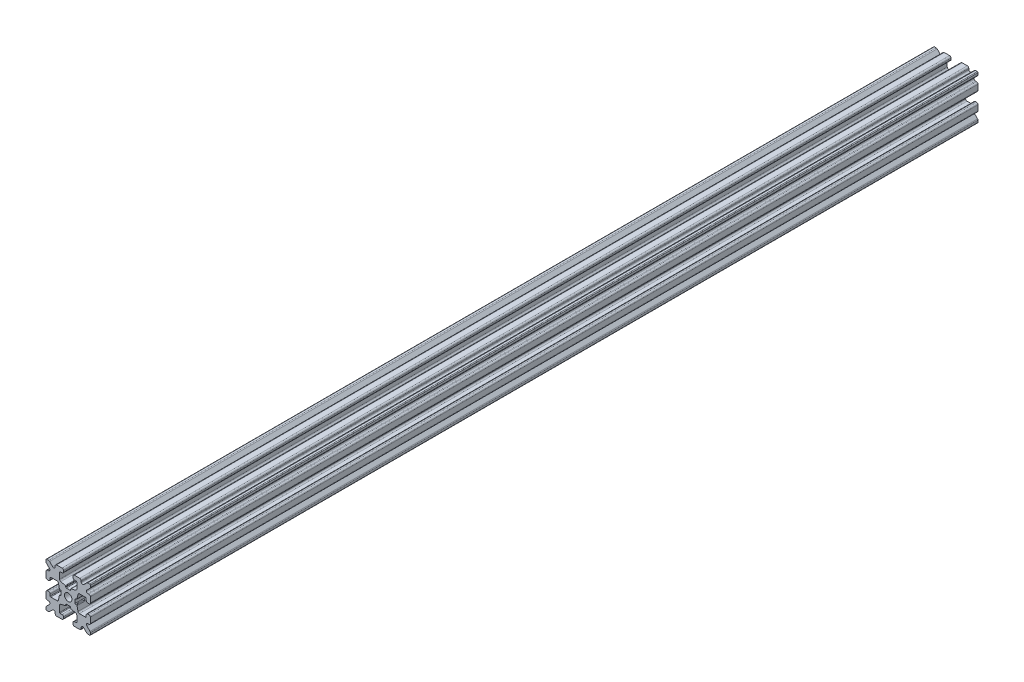
from build123d import *

# Parameters (mm, degrees)
SKETCH1_W           = 15
SKETCH1_H           = 15
SKETCH1_R           = 1.25
BOSS_EXTRUDE1_DEPTH = 150
FILLET1_R           = 0.25
CUT_EXTRUDE1_DEPTH  = 301.187441443
CUT_EXTRUDE3_DEPTH  = 301.187441443
FILLET3_R           = 0.5
FILLET4_R           = 0.5
FILLET5_R           = 3
FILLET6_R           = 0.2
CUT_EXTRUDE4_DEPTH  = 301.187441443
FILLET8_R           = 0.5
SKETCH6_W           = 5.1529354
SKETCH6_H           = 1.651
SKETCH6_W_2         = 1.651
SKETCH6_H_2         = 5.1529354
CUT_EXTRUDE5_DEPTH  = 301.187441443
FILLET10_R          = 0.2


with BuildPart() as part:
    # Sketch1 → Boss-Extrude1 (new, symmetric)
    with BuildSketch(Plane.XY):
        Rectangle(SKETCH1_W, SKETCH1_H)
        Circle(SKETCH1_R, mode=Mode.SUBTRACT)
    extrude(amount=BOSS_EXTRUDE1_DEPTH, both=True)

    # Fillet1
    fillet1_edges = [part.edges().sort_by_distance(p)[0] for p in [
        (7.5, -7.5, 0),
        (-7.5, -7.5, 0),
        (-7.5, 7.5, 0),
        (7.5, 7.5, 0),
    ]]
    fillet(fillet1_edges, radius=FILLET1_R)

    # Sketch2 → Cut-Extrude1 (cut, through all)
    with BuildSketch(Plane.XY.offset(150)):
        Polygon((-7.5, 1.6), (-6.1, 1.6), (-6.1, 2.9), (-3.4, 2.9), (-3.4, -2.9), (-6.1, -2.9), (-6.1, -1.6), (-7.5, -1.6), align=None)
        Polygon((2.9, 6.1), (1.6, 6.1), (1.6, 7.5), (-1.6, 7.5), (-1.6, 6.1), (-2.9, 6.1), (-2.9, 3.4), (2.9, 3.4), align=None)
        Polygon((-1.6, -7.5), (-1.6, -6.1), (-2.9, -6.1), (-2.9, -3.4), (2.9, -3.4), (2.9, -6.1), (1.6, -6.1), (1.6, -7.5), align=None)
        Polygon((6.1, -2.9), (6.1, -1.6), (7.5, -1.6), (7.5, 1.6), (6.1, 1.6), (6.1, 2.9), (3.4, 2.9), (3.4, -2.9), align=None)
    extrude(amount=-CUT_EXTRUDE1_DEPTH, mode=Mode.SUBTRACT)

    # Sketch4 → Cut-Extrude3 (cut, through all)
    with BuildSketch(Plane.XY.offset(150)):
        Polygon((-3.4, 2.9), (-2.75, 0), (-3.4, -2.9), align=None)
        Polygon((-2.9, 3.4), (0, 2.75), (2.9, 3.4), align=None)
        Polygon((3.4, 2.9), (2.75, 0), (3.4, -2.9), align=None)
        Polygon((-2.9, -3.4), (0, -2.75), (2.9, -3.4), align=None)
    extrude(amount=-CUT_EXTRUDE3_DEPTH, mode=Mode.SUBTRACT)

    # Fillet3
    fillet3_edges = [part.edges().sort_by_distance(p)[0] for p in [
        (1.6, -7.5, 0),
        (-1.6, -7.5, 0),
        (-1.6, -6.1, 0),
        (1.6, -6.1, 0),
        (6.1, 1.6, 0),
        (7.5, 1.6, 0),
        (7.5, -1.6, 0),
        (6.1, -1.6, 0),
        (-7.5, -1.6, 0),
        (-7.5, 1.6, 0),
        (-6.1, 1.6, 0),
        (-6.1, -1.6, 0),
        (-1.6, 6.1, 0),
        (-1.6, 7.5, 0),
        (1.6, 7.5, 0),
        (1.6, 6.1, 0),
    ]]
    fillet(fillet3_edges, radius=FILLET3_R)

    # Fillet4
    fillet4_edges = [part.edges().sort_by_distance(p)[0] for p in [
        (-2.9, -3.4, 0),
        (2.9, -3.4, 0),
        (3.4, -2.9, 0),
        (3.4, 2.9, 0),
        (-3.4, 2.9, 0),
        (-3.4, -2.9, 0),
        (2.9, 3.4, 0),
        (-2.9, 3.4, 0),
    ]]
    fillet(fillet4_edges, radius=FILLET4_R)

    # Fillet5
    fillet5_edges = [part.edges().sort_by_distance(p)[0] for p in [
        (-2.75, 0, 0),
        (0, 2.75, 0),
        (2.75, 0, 0),
        (0, -2.75, 0),
    ]]
    fillet(fillet5_edges, radius=FILLET5_R)

    # Fillet6
    fillet6_edges = [part.edges().sort_by_distance(p)[0] for p in [
        (-2.9, -6.1, 0),
        (2.9, -6.1, 0),
        (6.1, -2.9, 0),
        (6.1, 2.9, 0),
        (-6.1, 2.9, 0),
        (-6.1, -2.9, 0),
        (2.9, 6.1, 0),
        (-2.9, 6.1, 0),
    ]]
    fillet(fillet6_edges, radius=FILLET6_R)

    # Sketch5 → Cut-Extrude4 (cut, through all)
    with BuildSketch(Plane.XY.offset(150)):
        Polygon((-7.5, 6.439339828), (-5.460660172, 4.4), (-7.5, 4.4), align=None)
        Polygon((-6.439339828, 7.5), (-4.4, 5.460660172), (-4.4, 7.5), align=None)
        Polygon((4.4, 7.5), (6.439339828, 7.5), (4.4, 5.460660172), align=None)
        Polygon((7.5, 6.439339828), (7.5, 4.4), (5.460660172, 4.4), align=None)
        Polygon((7.5, -6.439339828), (5.460660172, -4.4), (7.5, -4.4), align=None)
        Polygon((6.439339828, -7.5), (4.4, -5.460660172), (4.4, -7.5), align=None)
        Polygon((-4.4, -7.5), (-6.439339828, -7.5), (-4.4, -5.460660172), align=None)
        Polygon((-7.5, -6.439339828), (-7.5, -4.4), (-5.460660172, -4.4), align=None)
    extrude(amount=-CUT_EXTRUDE4_DEPTH, mode=Mode.SUBTRACT)

    # Fillet8
    fillet8_edges = [part.edges().sort_by_distance(p)[0] for p in [
        (-7.5, 4.4, 0),
        (-7.5, 6.439339828, 0),
        (-5.460660172, 4.4, 0),
        (7.5, -4.4, 0),
        (7.5, -6.439339828, 0),
        (5.460660172, -4.4, 0),
        (5.460660172, 4.4, 0),
        (7.5, 6.439339828, 0),
        (7.5, 4.4, 0),
        (-4.4, 7.5, 0),
        (-4.4, 5.460660172, 0),
        (-6.439339828, 7.5, 0),
        (-5.460660172, -4.4, 0),
        (-7.5, -6.439339828, 0),
        (-7.5, -4.4, 0),
        (4.4, 5.460660172, 0),
        (4.4, 7.5, 0),
        (6.439339828, 7.5, 0),
        (6.439339828, -7.5, 0),
        (4.4, -7.5, 0),
        (4.4, -5.460660172, 0),
        (-6.439339828, -7.5, 0),
        (-4.4, -5.460660172, 0),
        (-4.4, -7.5, 0),
    ]]
    fillet(fillet8_edges, radius=FILLET8_R)

    # Sketch6 → Cut-Extrude5 (cut, through all)
    with BuildSketch(Plane.XY.offset(150)):
        with Locations((4.9235323, 0)):
            Rectangle(SKETCH6_W, SKETCH6_H)
        with Locations((0, -4.9235323)):
            Rectangle(SKETCH6_W_2, SKETCH6_H_2)
        with Locations((-4.9235323, 0)):
            Rectangle(SKETCH6_W, SKETCH6_H)
        with Locations((0, 4.9235323)):
            Rectangle(SKETCH6_W_2, SKETCH6_H_2)
    extrude(amount=-CUT_EXTRUDE5_DEPTH, mode=Mode.SUBTRACT)

    # Fillet10
    fillet10_edges = [part.edges().sort_by_distance(p)[0] for p in [
        (0.8255, -2.935025862, 0),
        (-0.8255, -2.935025862, 0),
        (0.8255, -2.3470646, 0),
        (-0.8255, -2.3470646, 0),
        (2.935025862, 0.8255, 0),
        (2.935025862, -0.8255, 0),
        (2.3470646, 0.8255, 0),
        (2.3470646, -0.8255, 0),
        (-2.935025862, -0.8255, 0),
        (-2.935025862, 0.8255, 0),
        (-2.3470646, -0.8255, 0),
        (-2.3470646, 0.8255, 0),
        (-0.8255, 2.935025862, 0),
        (0.8255, 2.935025862, 0),
        (-0.8255, 2.3470646, 0),
        (0.8255, 2.3470646, 0),
    ]]
    fillet(fillet10_edges, radius=FILLET10_R)


solid = part.part
